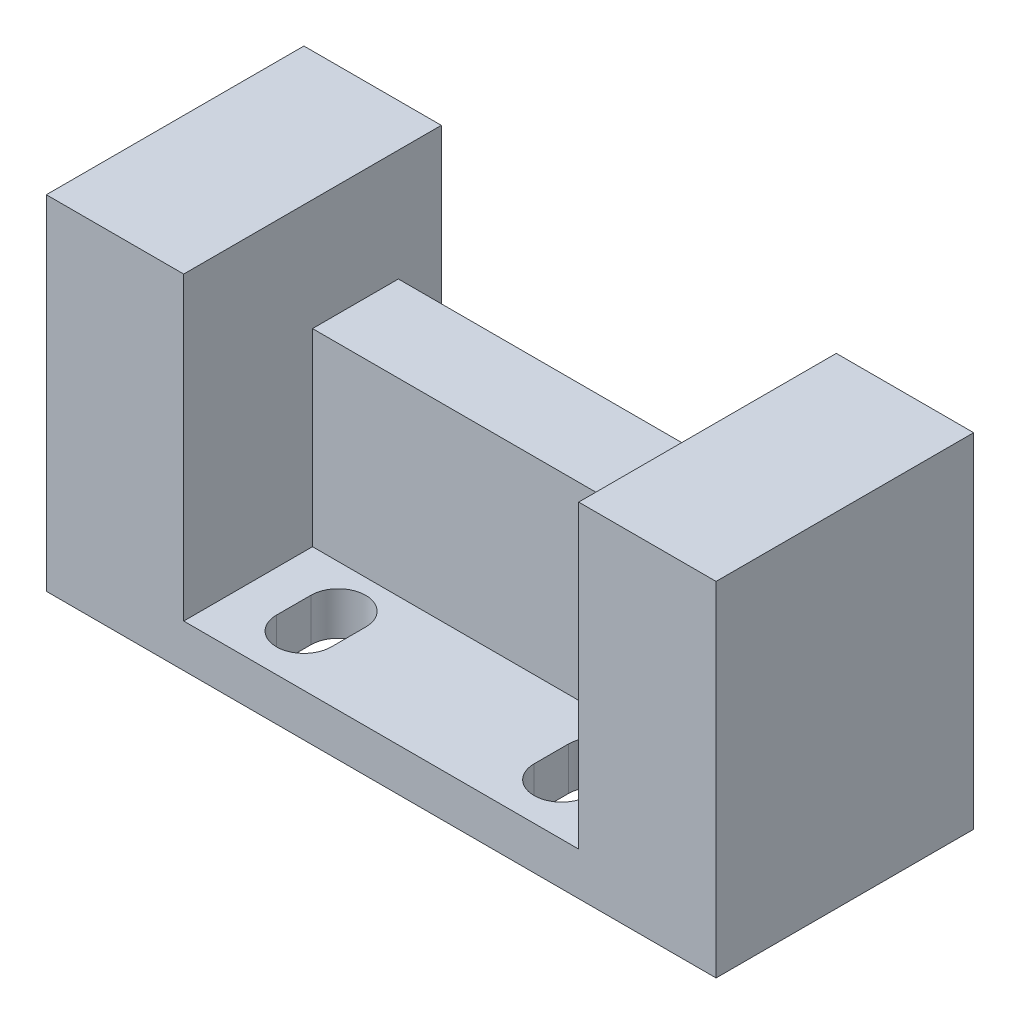
from build123d import *

# Parameters (mm, degrees)
SKETCH_1_W          = 8
SKETCH_1_H          = 20
EXTRUDE_1_DEPTH     = 10
EXTRUDE_1_2_DEPTH   = 10
SKETCH_2_W          = 39
SKETCH_2_H          = 15
EXTRUDE_2_DEPTH     = 2.5
CHAMFER_1_SIZE      = 1
SKETCH_3_R          = 2
CUT_EXTRUDE_1_DEPTH = 10
CUT_EXTRUDE_3_DEPTH = 10
SKETCH_6_W          = 5
SKETCH_6_H          = 17.5
EXTRUDE_3_DEPTH     = 8
SKETCH_7_W          = 5
SKETCH_7_H          = 17.5
EXTRUDE_4_DEPTH     = 8
EXTRUDE_5_REACH     = 41.825
SKETCH_8_W          = 5
SKETCH_8_H          = 11


with BuildPart() as part:
    # 草图1 → 凸台-拉伸1 (new body)
    with BuildSketch(Plane.XY):
        with Locations((4, 10)):
            Rectangle(SKETCH_1_W, SKETCH_1_H)
    extrude(amount=EXTRUDE_1_DEPTH)



with BuildPart() as body_2:
    # 草图1 → Extrude 1 2 (new body)
    with BuildSketch(Plane.XY):
        with Locations((35, 10)):
            Rectangle(SKETCH_1_W, SKETCH_1_H)
    extrude(amount=EXTRUDE_1_2_DEPTH)


with BuildPart() as part_1:
    add(part.part)

    add(body_2.part)  # 凸台-拉伸2 merges body 2
    # 草图2 → 凸台-拉伸2 (add)
    with BuildSketch(Plane.XZ):
        with Locations((19.5, 7.5)):
            Rectangle(SKETCH_2_W, SKETCH_2_H)
    extrude(amount=-EXTRUDE_2_DEPTH)

    # 倒角1
    chamfer_1_edges = [part_1.edges().sort_by_distance(p)[0] for p in [
        (19.5, 2.5, 0),
    ]]
    chamfer(chamfer_1_edges, length=CHAMFER_1_SIZE)

    # 草图3 → 切除-拉伸1 (cut)
    with BuildSketch(Plane(origin=(0, 0, 0), x_dir=(-1, 0, 0), z_dir=(0, 0, -1))):
        with Locations((-35.5, 17)):
            Circle(SKETCH_3_R)
        with Locations((-3.5, 17)):
            Circle(SKETCH_3_R)
        with Locations((-35.5, 4)):
            Circle(SKETCH_3_R)
        with Locations((-3.5, 4)):
            Circle(SKETCH_3_R)
    extrude(amount=-CUT_EXTRUDE_1_DEPTH, mode=Mode.SUBTRACT)

    # 草图5 → 切除-拉伸3 (cut)
    with BuildSketch(Plane(origin=(0, 2.5, 0), x_dir=(1, 0, 0), z_dir=(0, 1, 0))):
        with BuildLine():
            Line((10.4, -12), (10.4, -10))
            ThreePointArc((10.4, -10), (12, -8.4), (13.6, -10))
            Line((13.6, -10), (13.6, -12))
            ThreePointArc((13.6, -12), (12, -13.6), (10.4, -12))
        make_face()
        with BuildLine():
            Line((25.4, -12), (25.4, -10))
            ThreePointArc((25.4, -10), (27, -8.4), (28.6, -10))
            Line((28.6, -10), (28.6, -12))
            ThreePointArc((28.6, -12), (27, -13.6), (25.4, -12))
        make_face()
    extrude(amount=-CUT_EXTRUDE_3_DEPTH, mode=Mode.SUBTRACT)

    # 草图6 → 凸台-拉伸3 (add)
    with BuildSketch(Plane(origin=(39, 0, 0), x_dir=(0, 0, -1), z_dir=(1, 0, 0))):
        with Locations((-12.5, 11.25)):
            Rectangle(SKETCH_6_W, SKETCH_6_H)
    extrude(amount=-EXTRUDE_3_DEPTH)

    # 草图7 → 凸台-拉伸4 (add)
    with BuildSketch(Plane.ZY):
        with Locations((12.5, 11.25)):
            Rectangle(SKETCH_7_W, SKETCH_7_H)
    extrude(amount=-EXTRUDE_4_DEPTH)

    # 草图8 → 凸台-拉伸5 (add, up to next)
    with BuildSketch(Plane.ZY.offset(-31), mode=Mode.PRIVATE) as extrude_5_sk1:
        with Locations((5, 8)):
            Rectangle(SKETCH_8_W, SKETCH_8_H)
    extrude_5_tool1 = extrude(extrude_5_sk1.sketch, amount=EXTRUDE_5_REACH, mode=Mode.PRIVATE) - part_1.part
    add(extrude_5_tool1.solids().sort_by_distance((31, 8, 5))[0])


solid = part_1.part
